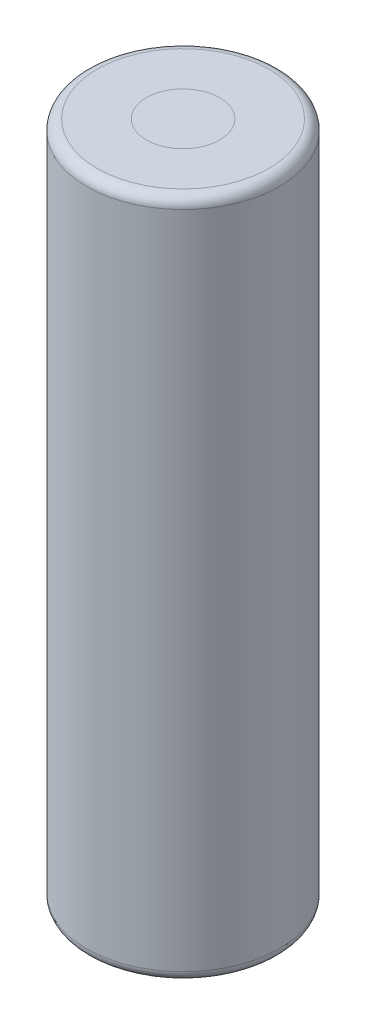
from build123d import *

# Parameters (mm, degrees)
SKETCH1_R           = 9.2
BOSS_EXTRUDE1_DEPTH = 32.5
FILLET1_R           = 1


with BuildPart() as part:
    # Sketch1 → Boss-Extrude1 (new, symmetric)
    with BuildSketch(Plane(origin=(0, 0, 0), x_dir=(1, 0, 0), z_dir=(0, 1, 0))):
        with Locations(Location((0, 0, 0), (0, 0, 270))):
            Circle(SKETCH1_R)
    extrude(amount=BOSS_EXTRUDE1_DEPTH, both=True)

    # Fillet1
    fillet1_edges = [part.edges().sort_by_distance(p)[0] for p in [
        (0, -32.5, -9.2),
        (0, 32.5, -9.2),
    ]]
    fillet(fillet1_edges, radius=FILLET1_R)


solid = part.part
